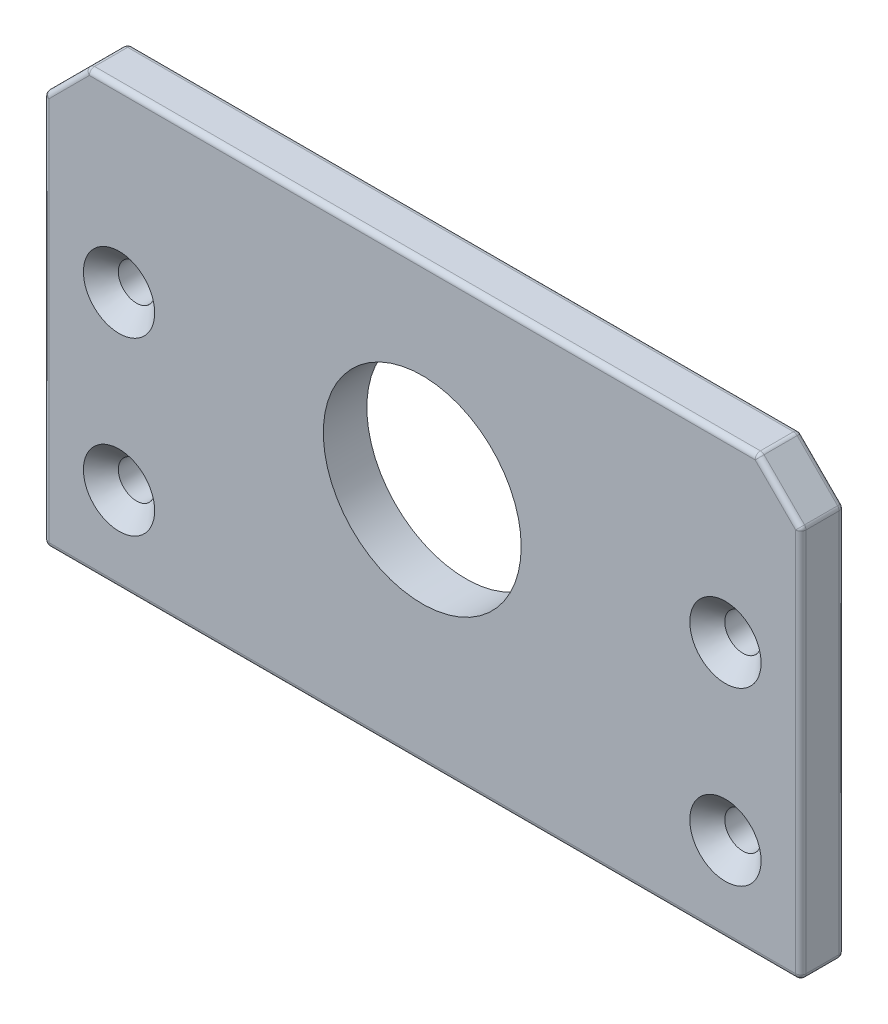
from build123d import *

# Parameters (mm, degrees)
SKETCH2_W                                       = 110.49
SKETCH2_H                                       = 6.35
BOSS_EXTRUDE1_DEPTH                             = 63.5
SKETCH3_R                                       = 14.43749998
CUT_EXTRUDE1_DEPTH                              = 85.407242136
CHAMFER1_SIZE                                   = 6.35
FILLET2_R                                       = 0.762
CSK_FOR_M5_FLAT_HEAD_MACHINE_SCREW1_D           = 5.3
CSK_FOR_M5_FLAT_HEAD_MACHINE_SCREW1_CSINK_D     = 10.4
CSK_FOR_M5_FLAT_HEAD_MACHINE_SCREW1_CSINK_ANGLE = 90


with BuildPart() as part:
    # Sketch2 → Boss-Extrude1 (new body)
    with BuildSketch(Plane(origin=(0, 0, 0), x_dir=(1, 0, 0), z_dir=(0, 1, 0))):
        Rectangle(SKETCH2_W, SKETCH2_H)
    extrude(amount=-BOSS_EXTRUDE1_DEPTH)

    # Sketch3 → Cut-Extrude1 (cut, through all)
    with BuildSketch(Plane.XY.offset(3.175)):
        with Locations((0, -28.8150046)):
            Circle(SKETCH3_R)
    extrude(amount=-CUT_EXTRUDE1_DEPTH, mode=Mode.SUBTRACT)

    # Chamfer1
    chamfer1_edges = [part.edges().sort_by_distance(p)[0] for p in [
        (55.245, 0, 0),
        (-55.245, 0, 0),
    ]]
    chamfer(chamfer1_edges, length=CHAMFER1_SIZE)

    # Fillet2
    fillet2_edges = [part.edges().sort_by_distance(p)[0] for p in [
        (55.245, -63.5, 0),
        (0, -63.5, -3.175),
        (0, 0, 3.175),
        (0, 0, -3.175),
        (48.895, 0, 0),
        (-48.895, 0, 0),
        (52.07, -3.175, 3.175),
        (-52.07, -3.175, 3.175),
        (-55.245, -6.35, 0),
        (52.07, -3.175, -3.175),
        (-52.07, -3.175, -3.175),
        (55.245, -6.35, 0),
        (-55.245, -63.5, 0),
        (-55.245, -34.925, -3.175),
        (55.245, -34.925, -3.175),
        (55.245, -34.925, 3.175),
        (-55.245, -34.925, 3.175),
        (0, -63.5, 3.175),
    ]]
    fillet(fillet2_edges, radius=FILLET2_R)

    # CSK for M5 Flat Head Machine Screw1 (through all)
    with Locations(Plane.XY.offset(3.175)):
        with Locations((-44.245, -26), (-44.245, -51), (44.245, -51), (44.245, -26)):
            CounterSinkHole(CSK_FOR_M5_FLAT_HEAD_MACHINE_SCREW1_D / 2, CSK_FOR_M5_FLAT_HEAD_MACHINE_SCREW1_CSINK_D / 2, counter_sink_angle=CSK_FOR_M5_FLAT_HEAD_MACHINE_SCREW1_CSINK_ANGLE)


solid = part.part
